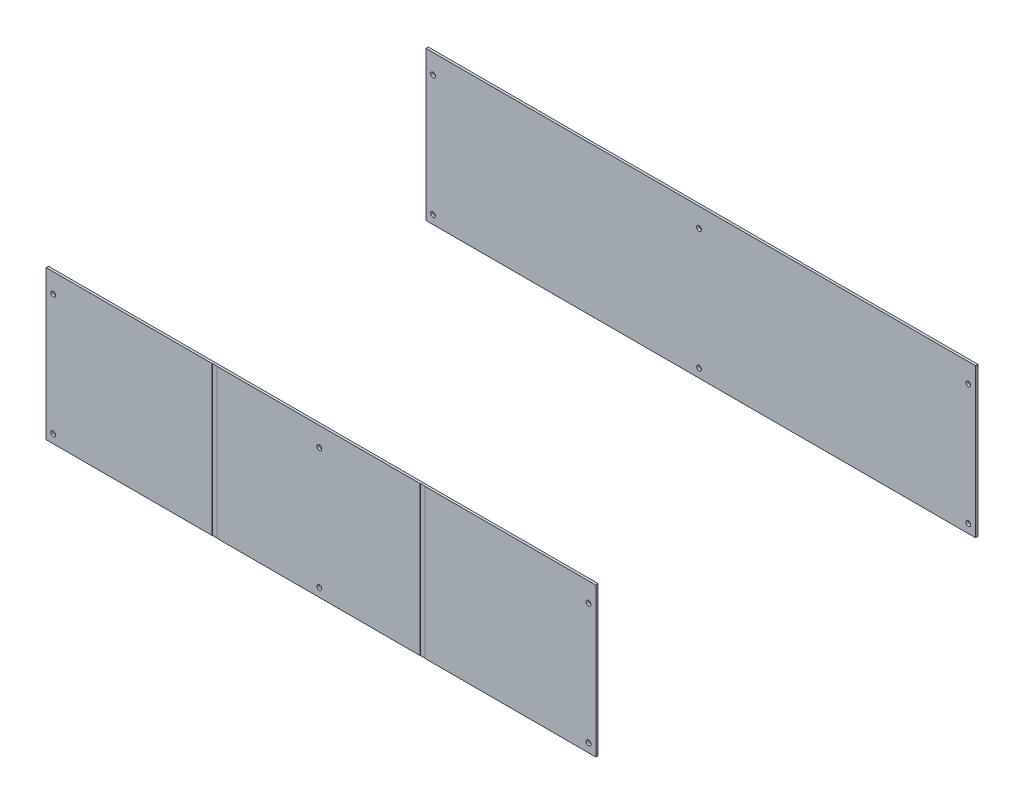
from build123d import *

# Parameters (mm, degrees)
SKETCH1_W               = 1136.5
SKETCH1_H               = 308
BOSS_EXTRUDE1_DEPTH     = 5
SKETCH2_W               = 10
SKETCH2_H               = 308
CUT_EXTRUDE_THIN1_DEPTH = 0.5
SKETCH3_R               = 5
CUT_EXTRUDE1_DEPTH      = 589.76910797


with BuildPart() as part:
    # Sketch1 → Boss-Extrude1 (new body)
    with BuildSketch(Plane.XY):
        Rectangle(SKETCH1_W, SKETCH1_H)
    extrude(amount=BOSS_EXTRUDE1_DEPTH)

    # Sketch2 → Cut-Extrude-Thin1 (cut)
    with BuildSketch(Plane.XY.offset(5)):
        with Locations((-220, 0)):
            Rectangle(SKETCH2_W, SKETCH2_H)
        with Locations((210, 0)):
            Rectangle(SKETCH2_W, SKETCH2_H)
    extrude(amount=-CUT_EXTRUDE_THIN1_DEPTH, mode=Mode.SUBTRACT)

    # Sketch3 → Cut-Extrude1 (cut, through all)
    with BuildSketch(Plane.XY.offset(5)):
        with Locations((-553.25, 114)):
            Circle(SKETCH3_R)
        with Locations(Location((-553.25, -136, 0), (0, 0, 180))):
            Circle(SKETCH3_R)
    cut_extrude1 = extrude(amount=-CUT_EXTRUDE1_DEPTH, mode=Mode.SUBTRACT)

    # Mirror3: Cut-Extrude1 across plane
    add(cut_extrude1.mirror(Plane.ZY.offset(278.25)), mode=Mode.SUBTRACT)

    # Mirror4: Cut-Extrude1 across plane
    add(cut_extrude1.mirror(Plane.ZY), mode=Mode.SUBTRACT)


with BuildPart() as body_2:
    # Mirror6: mirrored copy
    add(part.part.mirror(Plane(origin=(0, 0, -390), x_dir=(1, 0, 0), z_dir=(0, 0, -1))))


solid = Compound([part.part, body_2.part])
